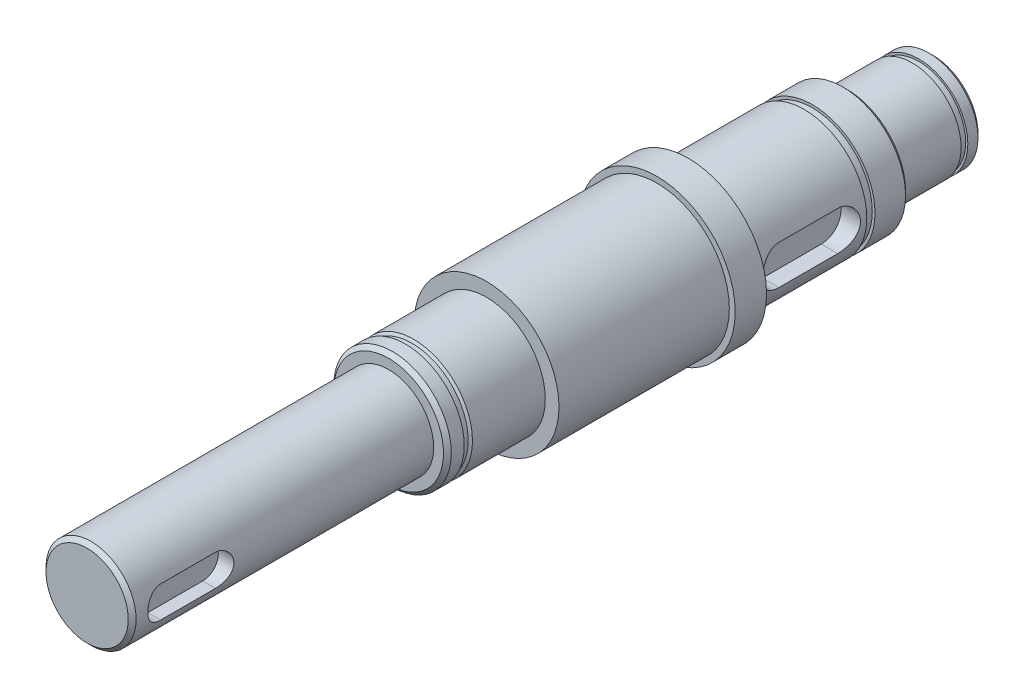
from build123d import *

# Parameters (mm, degrees)
TAGLIO_ESTRUSIONE4_START = 16
TAGLIO_ESTRUSIONE4_DEPTH = 5
TAGLIO_ESTRUSIONE5_START = 11.5
TAGLIO_ESTRUSIONE5_DEPTH = 4
SMUSSO5_SIZE             = 1


with BuildPart() as part:
    # Schizzo4 → Rivoluzione1 (revolve)
    with BuildSketch(Plane(origin=(0, 0, 0), x_dir=(0, 0, -1), z_dir=(1, 0, 0)), mode=Mode.PRIVATE) as rivoluzione1_sk:
        Polygon((0, 0), (216, 0), (216, 12.5), (194, 12.5), (194, 16), (153.5, 16), (153.5, 20), (145.5, 20), (145.5, 18.5), (102, 18.5), (102, 15), (77, 15), (77, 11.5), (0, 11.5), align=None)
    revolve(rivoluzione1_sk.sketch.rotate(Axis((0, 0, 0), (0, 0, -1)), 90), axis=Axis((0, 0, 0), (0, 0, -1)))

    # Schizzo10 → Taglia-Rivoluzione1 (revolve, cut)
    with BuildSketch(Plane(origin=(0, 0, 0), x_dir=(0, 0, -1), z_dir=(1, 0, 0)), mode=Mode.PRIVATE) as taglia_rivoluzione1_sk:
        Polygon((183.095854812, 16), (183.5, 15.3), (185.2, 15.3), (185.2, 16), align=None)
    revolve(taglia_rivoluzione1_sk.sketch.rotate(Axis((0, 0, -141.39065809), (0, 0, -1)), 90), axis=Axis((0, 0, -141.39065809), (0, 0, -1)), mode=Mode.SUBTRACT)

    # Schizzo11 → Taglia-Rivoluzione2 (revolve, cut)
    with BuildSketch(Plane(origin=(0, 0, 0), x_dir=(0, 0, -1), z_dir=(1, 0, 0)), mode=Mode.PRIVATE) as taglia_rivoluzione2_sk:
        Polygon((210.682457352, 12.5), (211, 11.95), (212.4, 11.95), (212.4, 12.5), align=None)
    revolve(taglia_rivoluzione2_sk.sketch.rotate(Axis((0, 0, -146.205163042), (0, 0, -1)), 90), axis=Axis((0, 0, -146.205163042), (0, 0, -1)), mode=Mode.SUBTRACT)

    # Schizzo12 → Taglia-Rivoluzione3 (revolve, cut)
    with BuildSketch(Plane(origin=(0, 0, 0), x_dir=(0, 0, -1), z_dir=(1, 0, 0)), mode=Mode.PRIVATE) as taglia_rivoluzione3_sk:
        Polygon((83.404145188, 15), (83, 14.3), (81.3, 14.3), (81.3, 15), align=None)
    revolve(taglia_rivoluzione3_sk.sketch.rotate(Axis((0, 0, -46.884155284), (0, 0, -1)), 90), axis=Axis((0, 0, -46.884155284), (0, 0, -1)), mode=Mode.SUBTRACT)

    # Schizzo6 → Taglio-Estrusione4 (cut)
    with BuildSketch(Plane(origin=(0, 0, 0), x_dir=(0, 0, -1), z_dir=(1, 0, 0)).offset(TAGLIO_ESTRUSIONE4_START)):
        with BuildLine():
            Line((161.5, 5), (176.5, 5))
            ThreePointArc((176.5, 5), (181.5, 0), (176.5, -5))
            Line((176.5, -5), (161.5, -5))
            ThreePointArc((161.5, -5), (156.5, 0), (161.5, 5))
        make_face()
    extrude(amount=-TAGLIO_ESTRUSIONE4_DEPTH, mode=Mode.SUBTRACT)

    # Schizzo8 → Taglio-Estrusione5 (cut)
    with BuildSketch(Plane(origin=(0, 0, 0), x_dir=(0, 0, -1), z_dir=(1, 0, 0)).offset(TAGLIO_ESTRUSIONE5_START)):
        with BuildLine():
            Line((8, 4), (22, 4))
            ThreePointArc((22, 4), (26, 0), (22, -4))
            Line((22, -4), (8, -4))
            ThreePointArc((8, -4), (4, 0), (8, 4))
        make_face()
    extrude(amount=-TAGLIO_ESTRUSIONE5_DEPTH, mode=Mode.SUBTRACT)

    # Smusso5
    smusso5_edges = [part.edges().sort_by_distance(p)[0] for p in [
        (-11.5, 0, 0),
        (-15, 0, -77),
        (-16, 0, -194),
        (-12.5, 0, -216),
    ]]
    chamfer(smusso5_edges, length=SMUSSO5_SIZE)


solid = part.part
